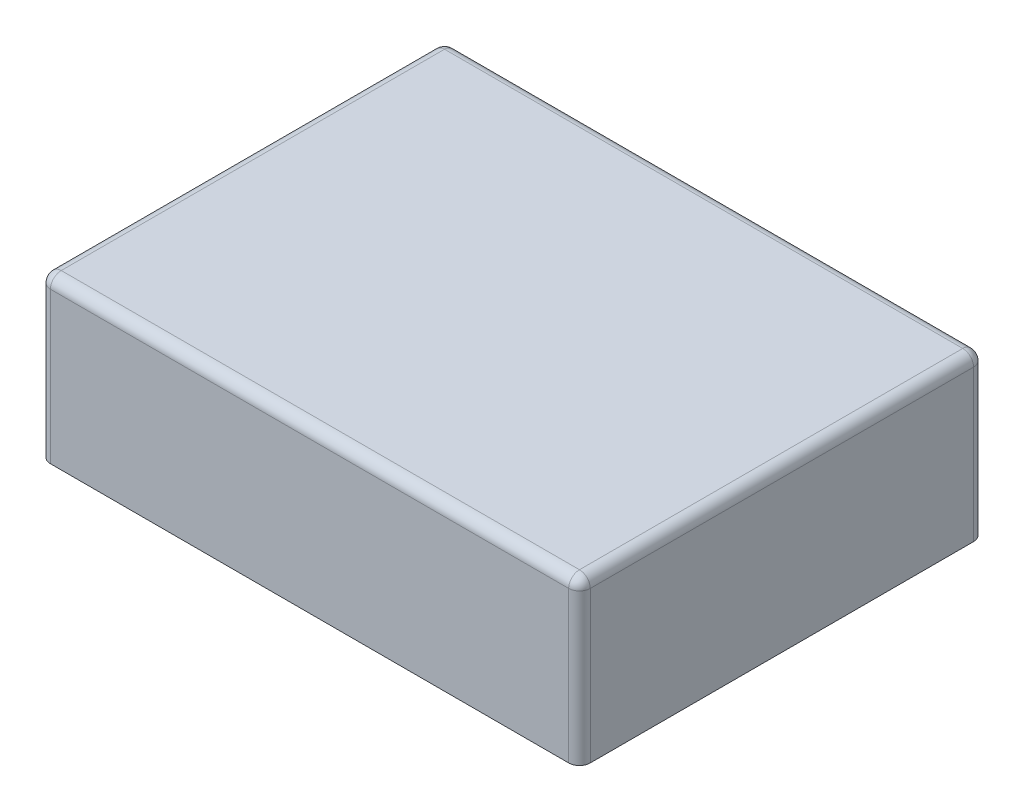
from build123d import *

# Parameters (mm, degrees)
SKETCH1_W           = 100
SKETCH1_H           = 75
BOSS_EXTRUDE1_DEPTH = 30
SHELL1_T            = -2
FILLET1_R           = 2


with BuildPart() as part:
    # Sketch1 → Boss-Extrude1 (new body)
    with BuildSketch(Plane(origin=(0, 0, 0), x_dir=(1, 0, 0), z_dir=(0, 1, 0))):
        Rectangle(SKETCH1_W, SKETCH1_H)
    extrude(amount=BOSS_EXTRUDE1_DEPTH)

    # Shell1
    shell1_openings = [part.faces().sort_by_distance(p)[0] for p in [
        (0, 0, 0),
    ]]
    offset(amount=SHELL1_T, openings=shell1_openings, kind=Kind.INTERSECTION)

    # Fillet1
    fillet1_edges = [part.edges().sort_by_distance(p)[0] for p in [
        (-50, 30, 0),
        (0, 30, 37.5),
        (50, 30, 0),
        (0, 30, -37.5),
        (50, 15, 37.5),
        (-50, 15, 37.5),
        (-50, 15, -37.5),
        (50, 15, -37.5),
    ]]
    fillet(fillet1_edges, radius=FILLET1_R)


solid = part.part
